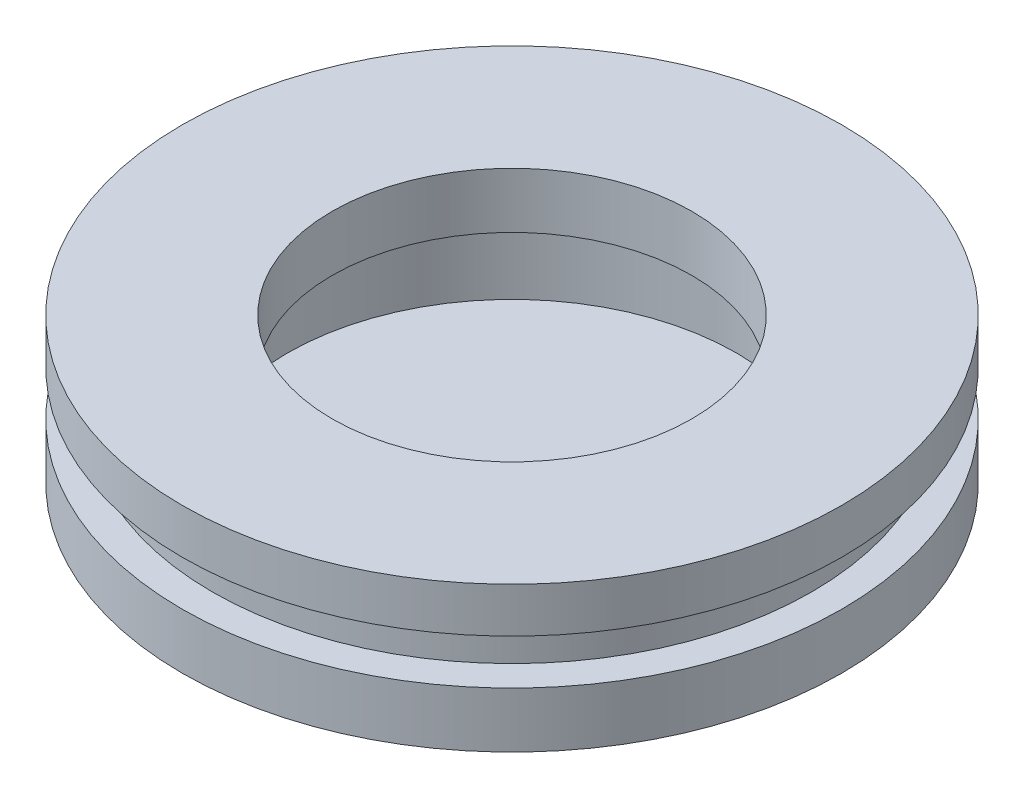
from build123d import *


with BuildPart() as part:
    # Esquisse1 → Révolution1 (revolve)
    with BuildSketch(Plane.XY, mode=Mode.PRIVATE) as r_volution1_sk:
        Polygon((0, 0), (0, 8.853672577), (-11, 8.853672577), (-11, 7.353672577), (-10, 7.353672577), (-10, 5.853672577), (-11, 5.853672577), (-11, 4.003672577), align=None)
    revolve(r_volution1_sk.sketch.rotate(Axis((0, 0, 0), (0, 1, 0)), 270), axis=Axis((0, 0, 0), (0, 1, 0)))

    # Esquisse3 → Enlèvement de matière-Révolution1 (revolve, cut)
    with BuildSketch(Plane.XY, mode=Mode.PRIVATE) as enl_vement_de_mati_re_r_volution1_sk:
        Polygon((-6, 10), (-6, 7), (-7.5, 7), (-7.5, 4.003672577), (0, 4.003672577), (0, 10), align=None)
    revolve(enl_vement_de_mati_re_r_volution1_sk.sketch.rotate(Axis((0, 0, 0), (0, 1, 0)), 270), axis=Axis((0, 0, 0), (0, 1, 0)), mode=Mode.SUBTRACT)


solid = part.part
